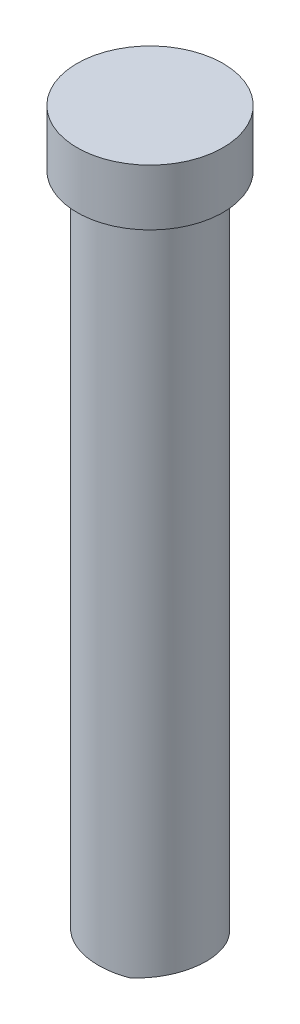
from build123d import *

# Parameters (mm, degrees)
CUT_EXTRUDE1_DEPTH = 65.854760812
CIRPATTERN1_COUNT  = 3


with BuildPart() as part:
    # Sketch1 → Revolve1 (revolve)
    with BuildSketch(Plane.XY, mode=Mode.PRIVATE) as revolve1_sk:
        Polygon((0, 0), (6.5, 0), (6.5, -5), (5, -5), (5, -64.2), (0, -64.2), align=None)
    revolve(revolve1_sk.sketch.rotate(Axis((0, -69.2, 0), (0, 1, 0)), 90), axis=Axis((0, -69.2, 0), (0, 1, 0)))

    # Sketch2 → Cut-Extrude1 (cut, symmetric)
    with BuildSketch(Plane.XY):
        Polygon((0, -64.2), (5, -63.497295826), (5, -64.2), align=None)
    cut_extrude1 = extrude(amount=CUT_EXTRUDE1_DEPTH, both=True, mode=Mode.SUBTRACT)

    # CirPattern1: Cut-Extrude1 ×3 about axis
    cirpattern1_axis = Axis((0, 0, 0), (0, 1, 0))
    for i in range(1, CIRPATTERN1_COUNT):
        add(cut_extrude1.rotate(cirpattern1_axis, i * 360 / CIRPATTERN1_COUNT), mode=Mode.SUBTRACT)


solid = part.part
